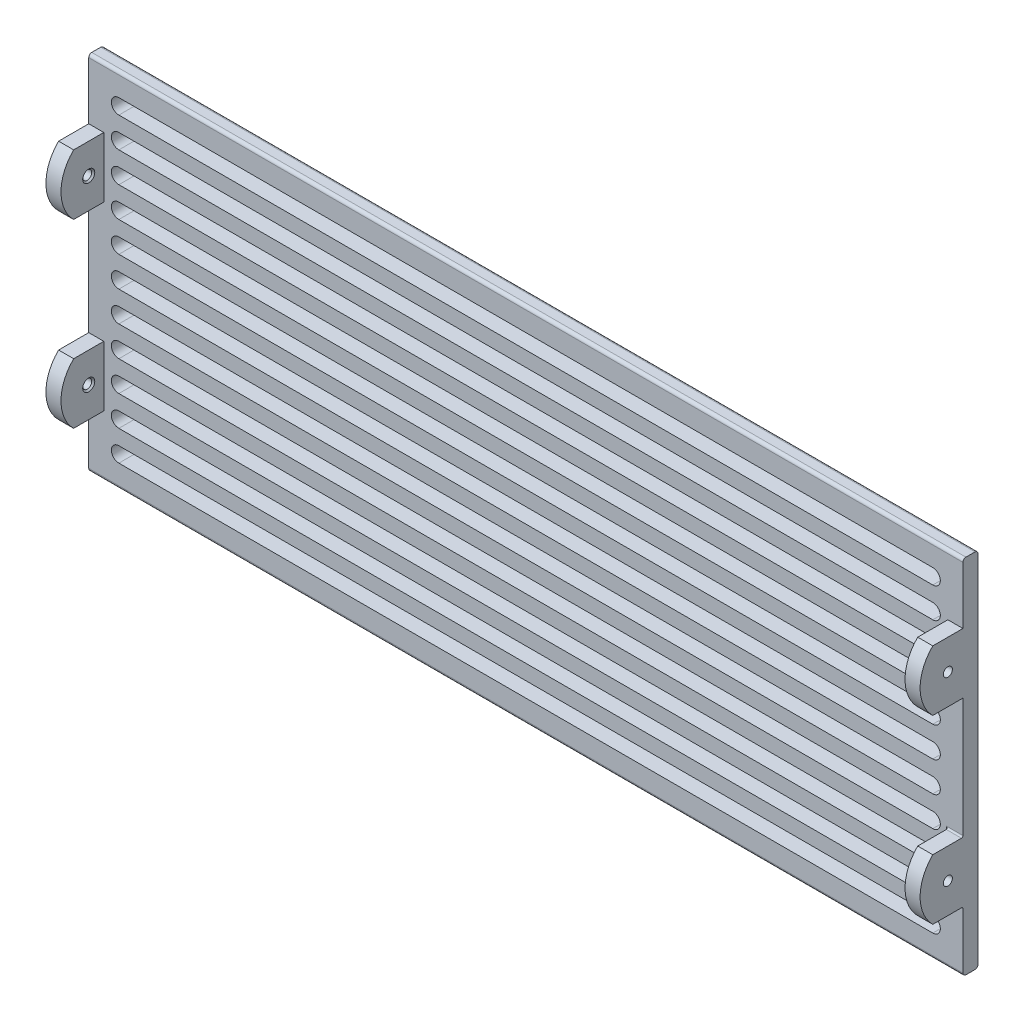
from build123d import *

# Parameters (mm, degrees)
ESQUISSE1_W        = 290
ESQUISSE1_H        = 120
BOSS_EXTRU_1_DEPTH = 5
CONG_1_R           = 1
CONG_2_R           = 1
ESQUISSE2_R        = 1.5
BOSS_EXTRU_2_DEPTH = 5
CONG_3_R           = 0.5
CHANFREIN1_SIZE    = 0.5


with BuildPart() as part:
    # Esquisse1 → Boss.-Extru.1 (new body)
    with BuildSketch(Plane.XY):
        Rectangle(ESQUISSE1_W, ESQUISSE1_H)
        with BuildLine():
            Line((-135, 2.5), (135, 2.5))
            ThreePointArc((135, 2.5), (137.5, 0), (135, -2.5))
            Line((135, -2.5), (-135, -2.5))
            ThreePointArc((-135, -2.5), (-137.5, 0), (-135, 2.5))
        make_face(mode=Mode.SUBTRACT)
        with BuildLine():
            Line((-135, 7.5), (135, 7.5))
            ThreePointArc((135, 7.5), (137.5, 10), (135, 12.5))
            Line((135, 12.5), (-135, 12.5))
            ThreePointArc((-135, 12.5), (-137.5, 10), (-135, 7.5))
        make_face(mode=Mode.SUBTRACT)
        with BuildLine():
            Line((-135, 17.5), (135, 17.5))
            ThreePointArc((135, 17.5), (137.5, 20), (135, 22.5))
            Line((135, 22.5), (-135, 22.5))
            ThreePointArc((-135, 22.5), (-137.5, 20), (-135, 17.5))
        make_face(mode=Mode.SUBTRACT)
        with BuildLine():
            Line((-135, 27.5), (135, 27.5))
            ThreePointArc((135, 27.5), (137.5, 30), (135, 32.5))
            Line((135, 32.5), (-135, 32.5))
            ThreePointArc((-135, 32.5), (-137.5, 30), (-135, 27.5))
        make_face(mode=Mode.SUBTRACT)
        with BuildLine():
            Line((-135, 37.5), (135, 37.5))
            ThreePointArc((135, 37.5), (137.5, 40), (135, 42.5))
            Line((135, 42.5), (-135, 42.5))
            ThreePointArc((-135, 42.5), (-137.5, 40), (-135, 37.5))
        make_face(mode=Mode.SUBTRACT)
        with BuildLine():
            Line((-135, 47.5), (135, 47.5))
            ThreePointArc((135, 47.5), (137.5, 50), (135, 52.5))
            Line((135, 52.5), (-135, 52.5))
            ThreePointArc((-135, 52.5), (-137.5, 50), (-135, 47.5))
        make_face(mode=Mode.SUBTRACT)
        with BuildLine():
            Line((-135, -12.5), (135, -12.5))
            ThreePointArc((135, -12.5), (137.5, -10), (135, -7.5))
            Line((135, -7.5), (-135, -7.5))
            ThreePointArc((-135, -7.5), (-137.5, -10), (-135, -12.5))
        make_face(mode=Mode.SUBTRACT)
        with BuildLine():
            Line((-135, -22.5), (135, -22.5))
            ThreePointArc((135, -22.5), (137.5, -20), (135, -17.5))
            Line((135, -17.5), (-135, -17.5))
            ThreePointArc((-135, -17.5), (-137.5, -20), (-135, -22.5))
        make_face(mode=Mode.SUBTRACT)
        with BuildLine():
            Line((-135, -32.5), (135, -32.5))
            ThreePointArc((135, -32.5), (137.5, -30), (135, -27.5))
            Line((135, -27.5), (-135, -27.5))
            ThreePointArc((-135, -27.5), (-137.5, -30), (-135, -32.5))
        make_face(mode=Mode.SUBTRACT)
        with BuildLine():
            Line((-135, -42.5), (135, -42.5))
            ThreePointArc((135, -42.5), (137.5, -40), (135, -37.5))
            Line((135, -37.5), (-135, -37.5))
            ThreePointArc((-135, -37.5), (-137.5, -40), (-135, -42.5))
        make_face(mode=Mode.SUBTRACT)
        with BuildLine():
            Line((-135, -52.5), (135, -52.5))
            ThreePointArc((135, -52.5), (137.5, -50), (135, -47.5))
            Line((135, -47.5), (-135, -47.5))
            ThreePointArc((-135, -47.5), (-137.5, -50), (-135, -52.5))
        make_face(mode=Mode.SUBTRACT)
    extrude(amount=BOSS_EXTRU_1_DEPTH)

    # Congé1
    cong_1_edges = [part.edges().sort_by_distance(p)[0] for p in [
        (0, -60, 5),
        (0, -60, 0),
    ]]
    fillet(cong_1_edges, radius=CONG_1_R)

    # Congé2
    cong_2_edges = [part.edges().sort_by_distance(p)[0] for p in [
        (0, 60, 0),
        (0, 60, 5),
    ]]
    fillet(cong_2_edges, radius=CONG_2_R)

    # Esquisse2 → Boss.-Extru.2 (add)
    # profile 1 of 2: a face of its own
    with BuildSketch(Plane(origin=(145, 0, 0), x_dir=(0, 0, -1), z_dir=(1, 0, 0))):
        with BuildLine():
            Line((-5, 20), (-15, 20))
            ThreePointArc((-15, 20), (-19.202041029, 30), (-15, 40))
            Line((-15, 40), (-5, 40))
            Line((-5, 40), (-5, 20))
        make_face()
        with Locations(Location((-10, 30, 0), (0, 0, 90))):
            Circle(ESQUISSE2_R, mode=Mode.SUBTRACT)
    # profile 2 of 2: a face of its own
    with BuildSketch(Plane(origin=(145, 0, 0), x_dir=(0, 0, -1), z_dir=(1, 0, 0))):
        with BuildLine():
            Line((-5, -20), (-5, -40))
            Line((-5, -40), (-15, -40))
            ThreePointArc((-15, -40), (-19.202041029, -30), (-15, -20))
            Line((-15, -20), (-5, -20))
        make_face()
        with Locations(Location((-10, -30, 0), (0, 0, 270))):
            Circle(ESQUISSE2_R, mode=Mode.SUBTRACT)
    boss_extru_2 = extrude(amount=-BOSS_EXTRU_2_DEPTH)

    # Symétrie1: Boss.-Extru.2 across plane
    add(boss_extru_2.mirror(Plane(origin=(0, 0, 0), x_dir=(0, 0, 1), z_dir=(1, 0, 0))))

    # Congé3
    cong_3_edges = [part.edges().sort_by_distance(p)[0] for p in [
        (140, -30, 5),
        (142.5, -20, 5),
        (142.5, -40, 5),
    ]]
    fillet(cong_3_edges, radius=CONG_3_R)

    # Chanfrein1
    chanfrein1_edges = [part.edges().sort_by_distance(p)[0] for p in [
        (140, 28.5, 10),
        (140, -28.5, 10),
        (-140, 28.5, 10),
        (-140, -28.5, 10),
    ]]
    chamfer(chanfrein1_edges, length=CHANFREIN1_SIZE)


solid = part.part
